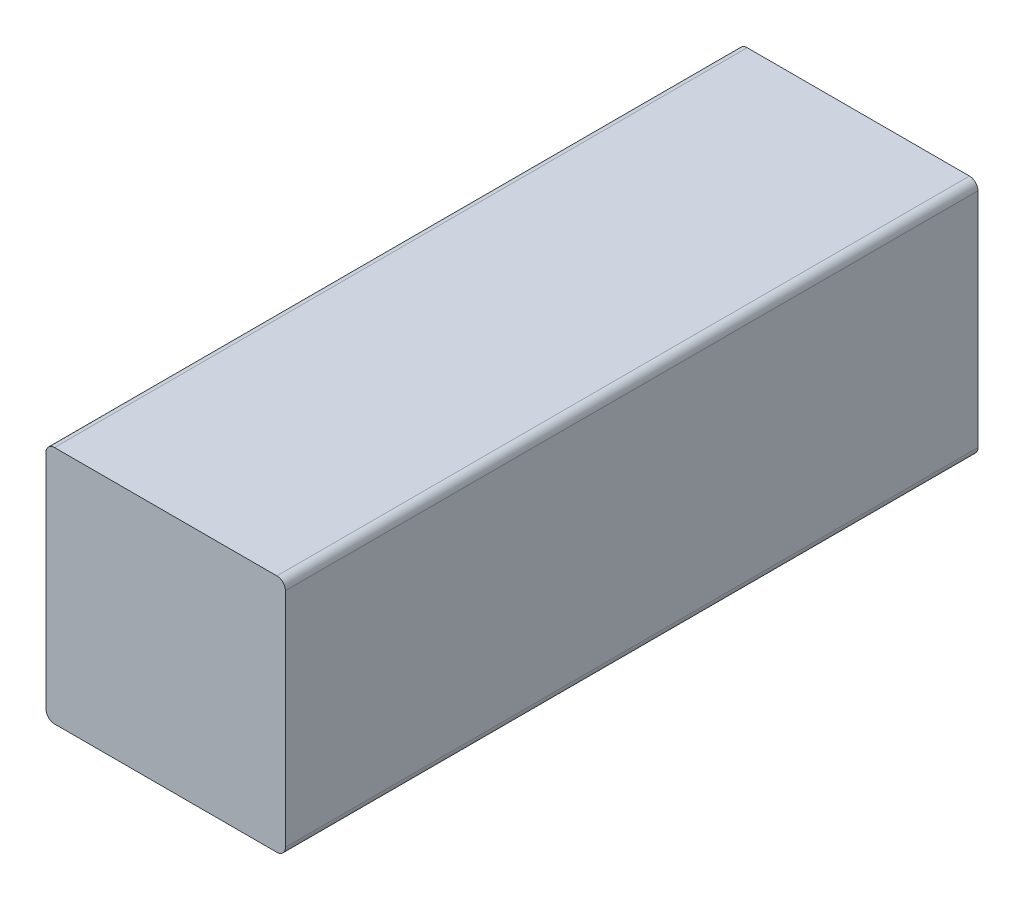
from build123d import *

# Parameters (mm, degrees)
SKETCH1_W           = 88.9
SKETCH1_H           = 257.175
BOSS_EXTRUDE1_DEPTH = 88.9
FILLET1_R           = 3.175


with BuildPart() as part:
    # Sketch1 → Boss-Extrude1 (new body)
    with BuildSketch(Plane(origin=(0, 0, 0), x_dir=(1, 0, 0), z_dir=(0, 1, 0))):
        Rectangle(SKETCH1_W, SKETCH1_H)
    extrude(amount=BOSS_EXTRUDE1_DEPTH)

    # Fillet1
    fillet1_edges = [part.edges().sort_by_distance(p)[0] for p in [
        (-44.45, 88.9, 0),
        (44.45, 88.9, 0),
        (-44.45, 0, 0),
        (44.45, 0, 0),
    ]]
    fillet(fillet1_edges, radius=FILLET1_R)


solid = part.part
